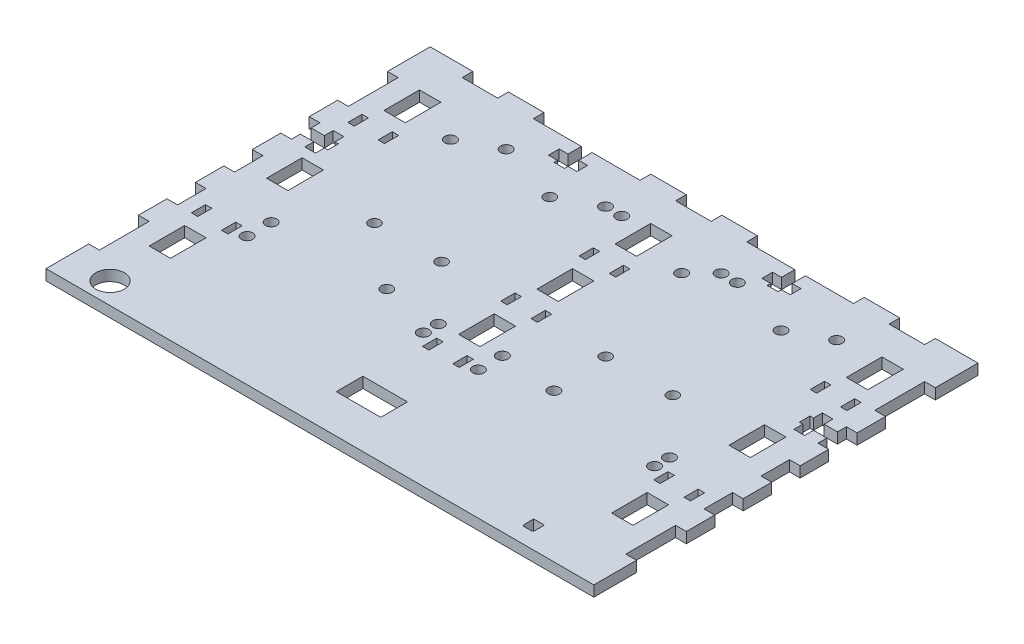
from build123d import *

# Parameters (mm, degrees)
CROQUIS1_R              = 4
SALIENTE_EXTRUIR1_DEPTH = 1.5
CROQUIS2_W              = 6
CROQUIS2_H              = 10
CROQUIS2_W_2            = 1.8
CROQUIS2_H_2            = 4
CORTAR_EXTRUIR1_DEPTH   = 3
CROQUIS3_W              = 12.5
CROQUIS3_H              = 7.5
CORTAR_EXTRUIR2_DEPTH   = 10
CROQUIS4_R              = 1.5875
CORTAR_EXTRUIR3_DEPTH   = 10
CROQUIS5_R              = 1.55
CORTAR_EXTRUIR4_DEPTH   = 10
CROQUIS6_R              = 1.5875
CROQUIS6_R_2            = 1.574835991
CORTAR_EXTRUIR5_DEPTH   = 10


with BuildPart() as part:
    # Croquis1 → Saliente-Extruir1 (new, symmetric)
    with BuildSketch(Plane(origin=(0, 0, 0), x_dir=(1, 0, 0), z_dir=(0, 1, 0))):
        Polygon((-77, -42), (-77, -54), (77, -54), (77, -42), (74, -42), (74, -28), (77, -28), (77, -20), (74, -20), (74, -12), (77, -12), (77, -4), (74, -4), (74, -1.5), (74, 1.5), (74, 4), (77, 4), (77, 12), (74, 12), (74, 14.5), (70.25, 14.5), (70.25, 12), (67.25, 12), (67.25, 14.5), (66.27, 14.5), (66.27, 17.5), (67.25, 17.5), (67.25, 20), (70.25, 20), (70.25, 17.5), (74, 17.5), (74, 20), (77, 20), (77, 28), (74, 28), (74, 42), (77, 42), (77, 54), (65, 54), (65, 51), (55, 51), (55, 54), (45, 54), (45, 51), (31.5, 51), (31.5, 47.25), (34, 47.25), (34, 44.25), (31.5, 44.25), (31.5, 43.27), (28.5, 43.27), (28.5, 44.25), (26, 44.25), (26, 47.25), (28.5, 47.25), (28.5, 51), (15, 51), (15, 54), (5, 54), (5, 51), (-5, 51), (-5, 54), (-15, 54), (-15, 51), (-28.5, 51), (-28.5, 47.25), (-26, 47.25), (-26, 44.25), (-28.5, 44.25), (-28.5, 43.27), (-31.5, 43.27), (-31.5, 44.25), (-34, 44.25), (-34, 47.25), (-31.5, 47.25), (-31.5, 51), (-45, 51), (-45, 54), (-55, 54), (-55, 51), (-65, 51), (-65, 54), (-77, 54), (-77, 42), (-74, 42), (-74, 28), (-77, 28), (-77, 20), (-74, 20), (-74, 17.5), (-70.25, 17.5), (-70.25, 20), (-67.25, 20), (-67.25, 17.5), (-66.27, 17.5), (-66.27, 14.5), (-67.25, 14.5), (-67.25, 12), (-70.25, 12), (-70.25, 14.5), (-74, 14.5), (-74, 12), (-77, 12), (-77, 4), (-74, 4), (-74, 1.5), (-74, -1.5), (-74, -4), (-77, -4), (-77, -12), (-74, -12), (-74, -20), (-77, -20), (-77, -28), (-74, -28), (-74, -42), align=None)
        with Locations(Location((-65, -48, 0), (0, 0, 270))):
            Circle(CROQUIS1_R, mode=Mode.SUBTRACT)
        with BuildLine():
            Line((55, -49.6), (53, -49.6))
            ThreePointArc((53, -49.6), (52.646446609, -49.453553391), (52.5, -49.1))
            Line((52.5, -49.1), (52.5, -46.4))
            Line((52.5, -46.4), (55.5, -46.4))
            Line((55.5, -46.4), (55.5, -49.1))
            ThreePointArc((55.5, -49.1), (55.353553391, -49.453553391), (55, -49.6))
        make_face(mode=Mode.SUBTRACT)
    extrude(amount=SALIENTE_EXTRUIR1_DEPTH, both=True)

    # Croquis2 → Cortar-Extruir1 (cut)
    with BuildSketch(Plane(origin=(0, 1.5, 0), x_dir=(1, 0, 0), z_dir=(0, 1, 0))):
        with Locations((0, 37)):
            Rectangle(CROQUIS2_W, CROQUIS2_H)
        with Locations((0, 15)):
            Rectangle(CROQUIS2_W, CROQUIS2_H)
        with Locations((0, -7)):
            Rectangle(CROQUIS2_W, CROQUIS2_H)
        with Locations((4.25, 26)):
            Rectangle(CROQUIS2_W_2, CROQUIS2_H_2)
        with Locations((65, 37)):
            Rectangle(CROQUIS2_W, CROQUIS2_H)
        with Locations((-65, 37)):
            Rectangle(CROQUIS2_W, CROQUIS2_H)
        with Locations((-4.25, 26)):
            Rectangle(CROQUIS2_W_2, CROQUIS2_H_2)
        with Locations((-4.25, 4)):
            Rectangle(CROQUIS2_W_2, CROQUIS2_H_2)
        with Locations((4.25, 4)):
            Rectangle(CROQUIS2_W_2, CROQUIS2_H_2)
        with Locations((4.25, -18)):
            Rectangle(CROQUIS2_W_2, CROQUIS2_H_2)
        with Locations((-4.25, -18)):
            Rectangle(CROQUIS2_W_2, CROQUIS2_H_2)
        with Locations((-60.75, 26)):
            Rectangle(CROQUIS2_W_2, CROQUIS2_H_2)
        with Locations((-69.25, 26)):
            Rectangle(CROQUIS2_W_2, CROQUIS2_H_2)
        with Locations((69.25, 26)):
            Rectangle(CROQUIS2_W_2, CROQUIS2_H_2)
        with Locations((60.75, 26)):
            Rectangle(CROQUIS2_W_2, CROQUIS2_H_2)
        with Locations((-65, 4)):
            Rectangle(CROQUIS2_W, CROQUIS2_H)
        with Locations((-69.25, -18)):
            Rectangle(CROQUIS2_W_2, CROQUIS2_H_2)
        with Locations((-60.75, -18)):
            Rectangle(CROQUIS2_W_2, CROQUIS2_H_2)
        with Locations((-65, -29)):
            Rectangle(CROQUIS2_W, CROQUIS2_H)
        with Locations((65, -29)):
            Rectangle(CROQUIS2_W, CROQUIS2_H)
        with Locations((60.75, -18)):
            Rectangle(CROQUIS2_W_2, CROQUIS2_H_2)
        with Locations((69.25, -18)):
            Rectangle(CROQUIS2_W_2, CROQUIS2_H_2)
        with Locations((65, 4)):
            Rectangle(CROQUIS2_W, CROQUIS2_H)
    extrude(amount=-CORTAR_EXTRUIR1_DEPTH, mode=Mode.SUBTRACT)

    # Croquis3 → Cortar-Extruir2 (cut)
    with BuildSketch(Plane(origin=(0, 1.5, 0), x_dir=(1, 0, 0), z_dir=(0, 1, 0))):
        with Locations((0, -39.4)):
            Rectangle(CROQUIS3_W, CROQUIS3_H)
    extrude(amount=-CORTAR_EXTRUIR2_DEPTH, mode=Mode.SUBTRACT)

    # Croquis4 → Cortar-Extruir3 (cut)
    with BuildSketch(Plane(origin=(0, 1.5, 0), x_dir=(1, 0, 0), z_dir=(0, 1, 0))):
        with Locations(Location((-41.39, 39.73, 0), (0, 0, 270))):
            Circle(CROQUIS4_R)
        with Locations(Location((-13.45, 39.73, 0), (0, 0, 270))):
            Circle(CROQUIS4_R)
        with Locations(Location((51.55, 39.73, 0), (0, 0, 270))):
            Circle(CROQUIS4_R)
        with Locations(Location((23.61, 39.73, 0), (0, 0, 270))):
            Circle(CROQUIS4_R)
        with Locations(Location((56.63, -12.34, 0), (0, 0, 270))):
            Circle(CROQUIS4_R)
        with Locations(Location((8.37, -11.07, 0), (0, 0, 270))):
            Circle(CROQUIS4_R)
        with Locations(Location((-8.37, -12.34, 0), (0, 0, 270))):
            Circle(CROQUIS4_R)
        with Locations(Location((-56.63, -11.07, 0), (0, 0, 270))):
            Circle(CROQUIS4_R)
        with Locations(Location((-24.13, -11.07, 0), (0, 0, 270))):
            Circle(CROQUIS4_R)
        with Locations(Location((24.13, -12.34, 0), (0, 0, 270))):
            Circle(CROQUIS4_R)
        with Locations(Location((19.05, 39.73, 0), (0, 0, 270))):
            Circle(CROQUIS4_R)
        with Locations(Location((-8.89, 39.73, 0), (0, 0, 270))):
            Circle(CROQUIS4_R)
    extrude(amount=-CORTAR_EXTRUIR3_DEPTH, mode=Mode.SUBTRACT)

    # Croquis5 → Cortar-Extruir4 (cut)
    with BuildSketch(Plane(origin=(0, 1.5, 0), x_dir=(1, 0, 0), z_dir=(0, 1, 0))):
        with Locations(Location((-41.925, 3.27, 0), (0, 0, 270))):
            Circle(CROQUIS5_R)
        with Locations(Location((-23.075, 3.27, 0), (0, 0, 270))):
            Circle(CROQUIS5_R)
        with Locations(Location((23.075, 3.27, 0), (0, 0, 270))):
            Circle(CROQUIS5_R)
        with Locations(Location((41.925, 3.27, 0), (0, 0, 270))):
            Circle(CROQUIS5_R)
    extrude(amount=-CORTAR_EXTRUIR4_DEPTH, mode=Mode.SUBTRACT)

    # Croquis6 → Cortar-Extruir5 (cut)
    with BuildSketch(Plane.XZ.offset(1.5)):
        with Locations(Location((-51.55, -34.24, 0), (0, 0, 270))):
            Circle(CROQUIS6_R)
        with Locations(Location((-23.61, -34.24, 0), (0, 0, 270))):
            Circle(CROQUIS6_R_2)
        with Locations(Location((13.45, -34.24, 0), (0, 0, 270))):
            Circle(CROQUIS6_R)
        with Locations(Location((41.39, -34.24, 0), (0, 0, 270))):
            Circle(CROQUIS6_R)
        with Locations(Location((56.63, 16.56, 0), (0, 0, 270))):
            Circle(CROQUIS6_R)
        with Locations(Location((8.37, 17.83, 0), (0, 0, 270))):
            Circle(CROQUIS6_R)
        with Locations(Location((-56.63, 17.83, 0), (0, 0, 270))):
            Circle(CROQUIS6_R)
        with Locations(Location((-8.37, 16.56, 0), (0, 0, 270))):
            Circle(CROQUIS6_R)
    extrude(amount=-CORTAR_EXTRUIR5_DEPTH, mode=Mode.SUBTRACT)


solid = part.part
